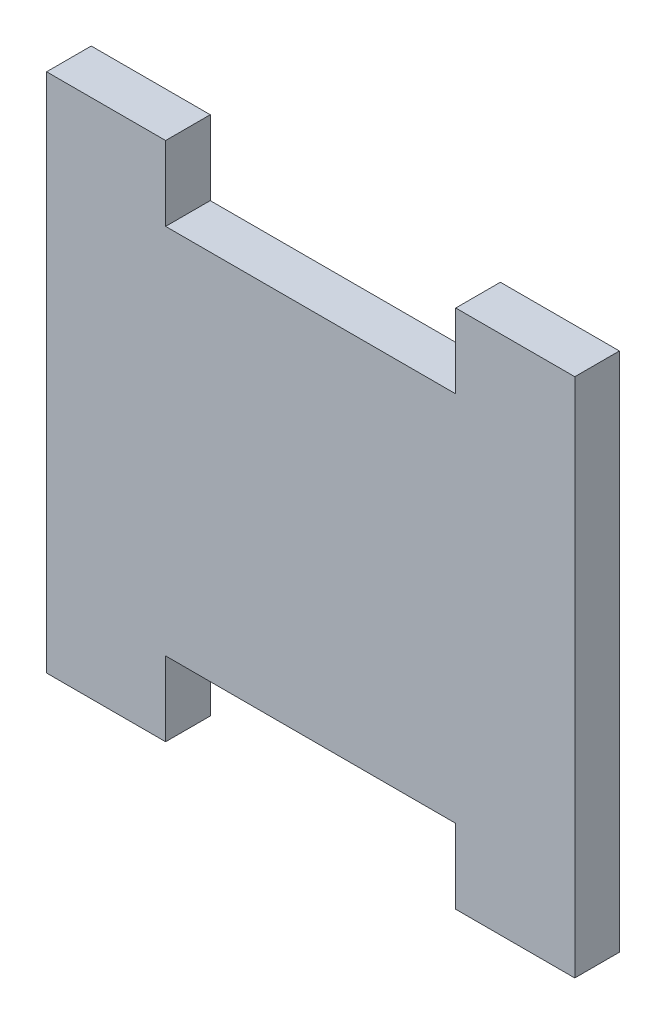
from build123d import *

# Parameters (mm, degrees)
RESSALTO_EXTRUS_O1_DEPTH = 3


with BuildPart() as part:
    # Esboço1 → Ressalto-extrusão1 (new body)
    with BuildSketch(Plane.XY):
        Polygon((-9.75, 13.00417228), (9.75, 13.00417228), (9.75, 18.00417228), (17.75, 18.00417228), (17.75, 13.00417228), (17.75, -16.99582772), (9.75, -16.99582772), (9.75, -11.99582772), (0, -11.99582772), (-9.75, -11.99582772), (-9.75, -16.99582772), (-17.75, -16.99582772), (-17.75, 13.00417228), (-17.75, 18.00417228), (-9.75, 18.00417228), align=None)
    extrude(amount=RESSALTO_EXTRUS_O1_DEPTH)


solid = part.part
